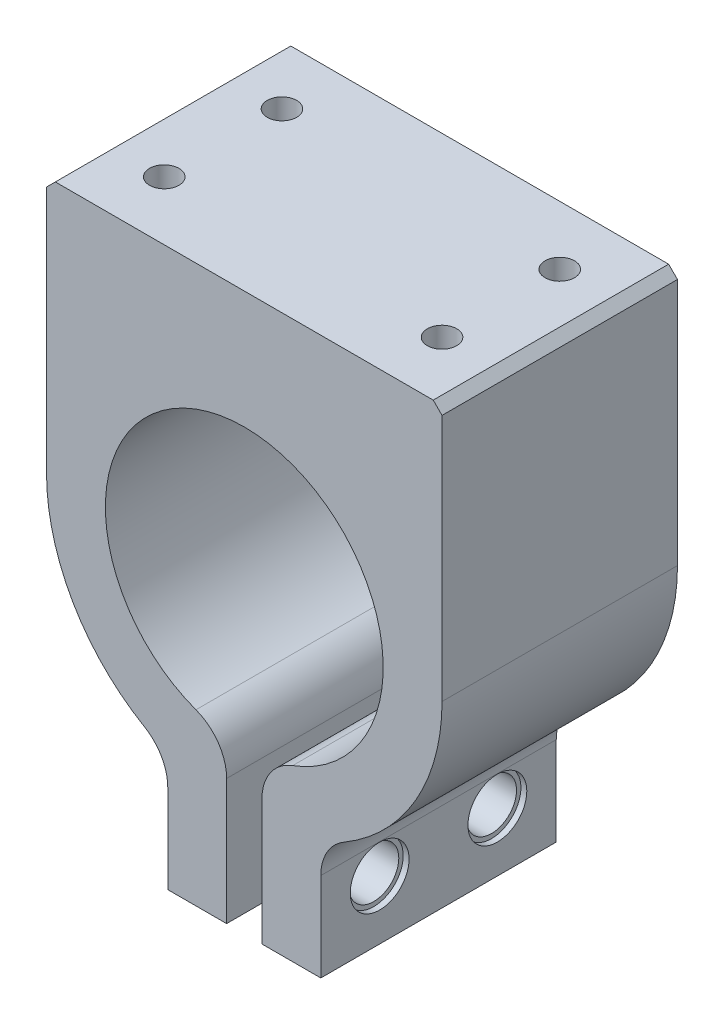
from build123d import *

# Parameters (mm, degrees)
BOSS_EXTRUDE1_DEPTH                              = 10
F_2_5_2_5_DIAMETER_HOLE1_D                       = 2.5
F_2_5_2_5_DIAMETER_HOLE1_DEPTH                   = 10
F_2_5_2_5_DIAMETER_HOLE1_TIP                     = 1.25
CBORE_FOR_M5_HEX_HEAD_MACHINE_SCREW2_D           = 4.25
CBORE_FOR_M5_HEX_HEAD_MACHINE_SCREW2_DEPTH       = 5
CBORE_FOR_M5_HEX_HEAD_MACHINE_SCREW2_CBORE_D     = 5
CBORE_FOR_M5_HEX_HEAD_MACHINE_SCREW2_CBORE_DEPTH = 0.5
CBORE_FOR_M5_HEX_HEAD_MACHINE_SCREW2_TIP         = 1.276828815
M3_CLEARANCE_HOLE1_D                             = 3.4
M3_CLEARANCE_HOLE1_DEPTH                         = 5
M3_CLEARANCE_HOLE1_TIP                           = 1.021463052
FILLET1_R                                        = 4
CHAMFER1_SIZE                                    = 0.75


with BuildPart() as part:
    # Sketch1 → Boss-Extrude1 (new, symmetric)
    with BuildSketch(Plane.XY):
        with BuildLine():
            Line((6.5, -25.491610633), (6.5, -15.491610633))
            ThreePointArc((6.5, -15.491610633), (4.047863744, -16.305054404), (1.5, -16.732901721))
            Line((1.5, -16.732901721), (1.5, -25.491610633))
            Line((1.5, -25.491610633), (6.5, -25.491610633))
        make_face()
        with BuildLine():
            ThreePointArc((-1.5, -16.732901721), (-4.047863744, -16.305054404), (-6.5, -15.491610633))
            Line((-6.5, -15.491610633), (-6.5, -25.491610633))
            Line((-6.5, -25.491610633), (-1.5, -25.491610633))
            Line((-1.5, -25.491610633), (-1.5, -16.732901721))
        make_face()
        with BuildLine():
            Line((-16.8, 21.8), (-16.8, 0))
            ThreePointArc((-16.8, 0), (-13.989996426, -9.301612763), (-6.5, -15.491610633))
            ThreePointArc((-6.5, -15.491610633), (-4.047863744, -16.305054404), (-1.5, -16.732901721))
            Line((-1.5, -16.732901721), (-1.5, -11.704272724))
            ThreePointArc((-1.5, -11.704272724), (-7.795511529, 8.858329414), (11.8, 0))
            ThreePointArc((11.8, 0), (8.858329414, -7.795511529), (1.5, -11.704272724))
            Line((1.5, -11.704272724), (1.5, -16.732901721))
            ThreePointArc((1.5, -16.732901721), (4.047863744, -16.305054404), (6.5, -15.491610633))
            ThreePointArc((6.5, -15.491610633), (13.989996426, -9.301612763), (16.8, 0))
            Line((16.8, 0), (16.8, 21.8))
            Line((16.8, 21.8), (-16.8, 21.8))
        make_face()
    extrude(amount=BOSS_EXTRUDE1_DEPTH, both=True)

    # Ø2.5 (2.5) Diameter Hole1
    with Locations(Plane(origin=(0, 21.8, 0), x_dir=(1, 0, 0), z_dir=(0, 1, 0))):
        with Locations((-11.8, -5), (-11.8, 5), (11.8, 5), (11.8, -5)):
            Hole(F_2_5_2_5_DIAMETER_HOLE1_D / 2, depth=F_2_5_2_5_DIAMETER_HOLE1_DEPTH)
            with Locations((0, 0, -(F_2_5_2_5_DIAMETER_HOLE1_DEPTH + F_2_5_2_5_DIAMETER_HOLE1_TIP / 2))):  # 90° drill point
                Cone(0, F_2_5_2_5_DIAMETER_HOLE1_D / 2, F_2_5_2_5_DIAMETER_HOLE1_TIP, mode=Mode.SUBTRACT)

    # CBORE for M5 Hex Head Machine Screw2
    with Locations(Plane(origin=(6.5, 0, 0), x_dir=(0, 0, -1), z_dir=(1, 0, 0))):
        with Locations((5, -20.491610633), (-5, -20.491610633)):
            CounterBoreHole(CBORE_FOR_M5_HEX_HEAD_MACHINE_SCREW2_D / 2, CBORE_FOR_M5_HEX_HEAD_MACHINE_SCREW2_CBORE_D / 2, CBORE_FOR_M5_HEX_HEAD_MACHINE_SCREW2_CBORE_DEPTH, depth=CBORE_FOR_M5_HEX_HEAD_MACHINE_SCREW2_DEPTH)
            with Locations((0, 0, -(CBORE_FOR_M5_HEX_HEAD_MACHINE_SCREW2_DEPTH + CBORE_FOR_M5_HEX_HEAD_MACHINE_SCREW2_TIP / 2))):  # 118° drill point
                Cone(0, CBORE_FOR_M5_HEX_HEAD_MACHINE_SCREW2_D / 2, CBORE_FOR_M5_HEX_HEAD_MACHINE_SCREW2_TIP, mode=Mode.SUBTRACT)

    # M3 Clearance Hole1
    with Locations(Plane.ZY.offset(6.5)):
        with Locations((-5, -20.491610633), (5, -20.491610633)):
            Hole(M3_CLEARANCE_HOLE1_D / 2, depth=M3_CLEARANCE_HOLE1_DEPTH)
            with Locations((0, 0, -(M3_CLEARANCE_HOLE1_DEPTH + M3_CLEARANCE_HOLE1_TIP / 2))):  # 118° drill point
                Cone(0, M3_CLEARANCE_HOLE1_D / 2, M3_CLEARANCE_HOLE1_TIP, mode=Mode.SUBTRACT)

    # Fillet1
    fillet1_edges = [part.edges().sort_by_distance(p)[0] for p in [
        (1.5, -11.704272724, 0),
        (-1.5, -11.704272724, 0),
        (-6.5, -15.491610633, 0),
        (6.5, -15.491610633, 0),
    ]]
    fillet(fillet1_edges, radius=FILLET1_R)

    # Chamfer1
    chamfer1_edges = [part.edges().sort_by_distance(p)[0] for p in [
        (-16.8, 21.8, 0),
        (16.8, 21.8, 0),
    ]]
    chamfer(chamfer1_edges, length=CHAMFER1_SIZE)


solid = part.part
